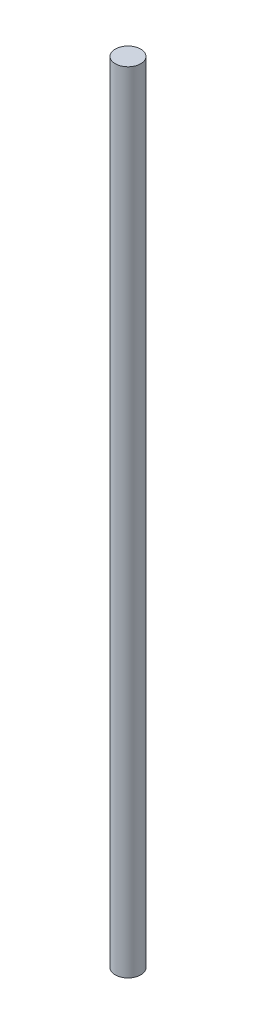
from build123d import *

# Parameters (mm, degrees)
SKETCH1_R           = 2
BOSS_EXTRUDE1_DEPTH = 124


with BuildPart() as part:
    # Sketch1 → Boss-Extrude1 (new body)
    with BuildSketch(Plane(origin=(0, 0, 0), x_dir=(1, 0, 0), z_dir=(0, 1, 0))):
        with Locations(Location((0, 0, 0), (0, 0, 270))):
            Circle(SKETCH1_R)
    extrude(amount=BOSS_EXTRUDE1_DEPTH)


solid = part.part
